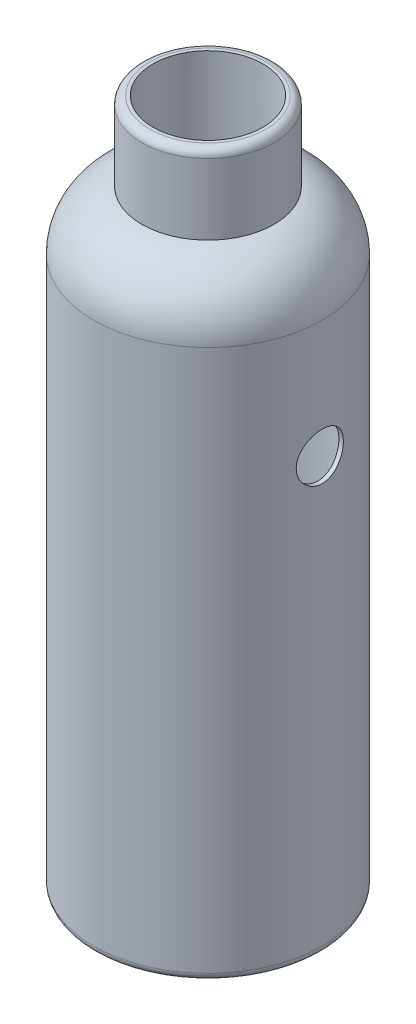
from build123d import *

# Parameters (mm, degrees)
SKETCH1_R               = 36.96335
BOSS_EXTRUDE1_DEPTH     = 171.45
FILLET1_R               = 2.54
SKETCH10_R              = 36.96335
BOSS_EXTRUDE2_DEPTH     = 25.4
FILLET2_R               = 19.05
SKETCH11_R              = 21.36775
BOSS_EXTRUDE3_DEPTH     = 25.4
FILLET3_R               = 2.54
SKETCH12_R              = 17.78
CUT_EXTRUDE1_DEPTH      = 221.742
SKETCH13_R              = 35.56
CUT_EXTRUDE2_DEPTH      = 171.45
CUT_EXTRUDE3_DEPTH      = 229.314784975
CUT_EXTRUDE3_DEPTH_BACK = 2.54
SKETCH15_R              = 7.62


with BuildPart() as part:
    # Sketch1 → Boss-Extrude1 (new body)
    with BuildSketch(Plane(origin=(0, 0, 0), x_dir=(1, 0, 0), z_dir=(0, 1, 0))):
        with Locations(Location((0, 0, 0), (0, 0, 270))):
            Circle(SKETCH1_R)
    extrude(amount=BOSS_EXTRUDE1_DEPTH)

    # Fillet1
    fillet1_edges = [part.edges().sort_by_distance(p)[0] for p in [
        (0, 0, -36.96335),
    ]]
    fillet(fillet1_edges, radius=FILLET1_R)

    # Sketch10 → Boss-Extrude2 (add)
    with BuildSketch(Plane(origin=(0, 171.45, 0), x_dir=(1, 0, 0), z_dir=(0, 1, 0))):
        with Locations(Location((0, 0, 0), (0, 0, 270))):
            Circle(SKETCH10_R)
    extrude(amount=BOSS_EXTRUDE2_DEPTH)

    # Fillet2
    fillet2_edges = [part.edges().sort_by_distance(p)[0] for p in [
        (0, 196.85, -36.96335),
    ]]
    fillet(fillet2_edges, radius=FILLET2_R)

    # Sketch11 → Boss-Extrude3 (add)
    with BuildSketch(Plane(origin=(0, 196.85, 0), x_dir=(1, 0, 0), z_dir=(0, 1, 0))):
        with Locations(Location((0, 0, 0), (0, 0, 270))):
            Circle(SKETCH11_R)
    extrude(amount=BOSS_EXTRUDE3_DEPTH)

    # Fillet3
    fillet3_edges = [part.edges().sort_by_distance(p)[0] for p in [
        (0, 222.25, -21.36775),
    ]]
    fillet(fillet3_edges, radius=FILLET3_R)

    # Sketch12 → Cut-Extrude1 (cut)
    with BuildSketch(Plane(origin=(0, 222.25, 0), x_dir=(1, 0, 0), z_dir=(0, 1, 0))):
        with Locations(Location((0, 0, 0), (0, 0, 270))):
            Circle(SKETCH12_R)
    extrude(amount=-CUT_EXTRUDE1_DEPTH, mode=Mode.SUBTRACT)

    # Sketch13 → Cut-Extrude2 (cut)
    with BuildSketch(Plane(origin=(0, 0.508, 0), x_dir=(1, 0, 0), z_dir=(0, 1, 0))):
        with Locations(Location((0, 0, 0), (0, 0, 270))):
            Circle(SKETCH13_R)
    extrude(amount=CUT_EXTRUDE2_DEPTH, mode=Mode.SUBTRACT)

    # Sketch14 → Cut-Revolve1 (revolve, cut)
    with BuildSketch(Plane.XY, mode=Mode.PRIVATE) as cut_revolve1_sk:
        with BuildLine():
            Line((35.56, 171.958), (0, 171.958))
            Line((0, 171.958), (0, 196.85))
            Line((0, 196.85), (16.51, 196.85))
            ThreePointArc((16.51, 196.85), (29.980384182, 191.270384182), (35.56, 177.8))
            Line((35.56, 177.8), (35.56, 171.958))
        make_face()
    revolve(cut_revolve1_sk.sketch.rotate(Axis((0, 171.958, 0), (0, 1, 0)), 90), axis=Axis((0, 171.958, 0), (0, 1, 0)), mode=Mode.SUBTRACT)

    # Sketch15 → Cut-Extrude3 (cut, two sides: drawn at the far end of the back side and taken through both)
    with BuildSketch(Plane(origin=(0, 0, 0), x_dir=(0, 0, -1), z_dir=(1, 0, 0)).offset(-CUT_EXTRUDE3_DEPTH_BACK)):
        with Locations(Location((0, 139.7, 0), (0, 0, 180))):
            Circle(SKETCH15_R)
    extrude(amount=CUT_EXTRUDE3_DEPTH + CUT_EXTRUDE3_DEPTH_BACK, mode=Mode.SUBTRACT)


solid = part.part
